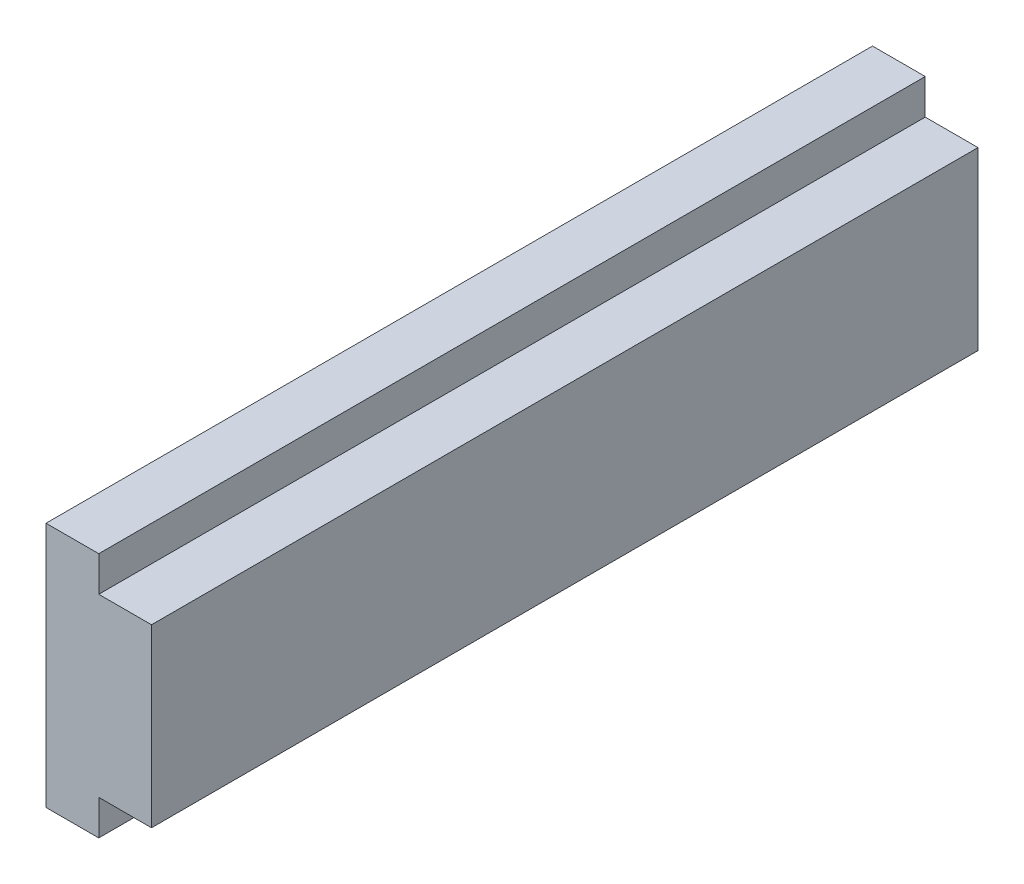
from build123d import *

# Parameters (mm, degrees)
SKETCH_1_W      = 3
SKETCH_1_H      = 14
SKETCH_1_H_2    = 10
EXTRUDE_1_DEPTH = 47


with BuildPart() as part:
    # 스케치1 → 보스-돌출1 (new body)
    with BuildSketch(Plane.XY):
        with Locations((1.5, 7)):
            Rectangle(SKETCH_1_W, SKETCH_1_H)
        with Locations((4.5, 7)):
            Rectangle(SKETCH_1_W, SKETCH_1_H_2)
    extrude(amount=EXTRUDE_1_DEPTH)


solid = part.part
